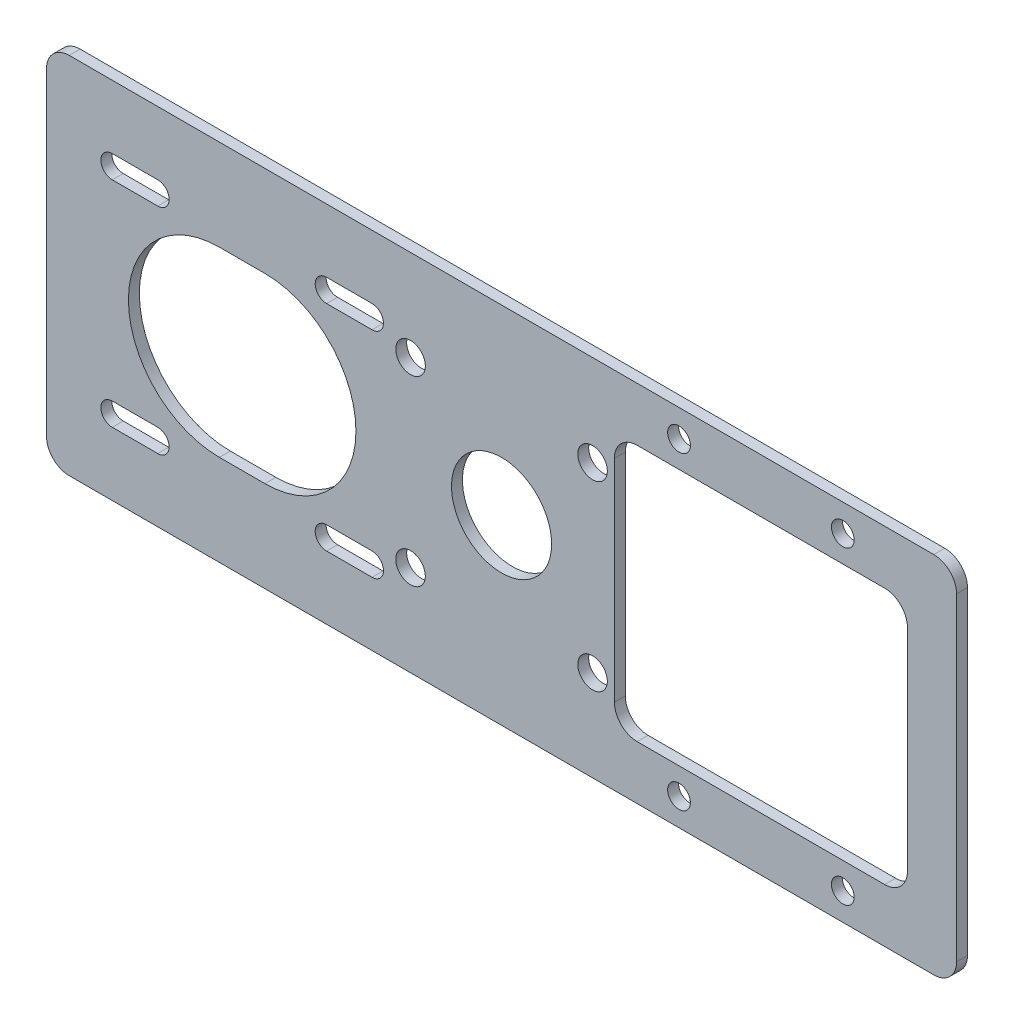
from build123d import *

# Parameters (mm, degrees)
CROQUIS1_W              = 200
CROQUIS1_H              = 80
SALIENTE_EXTRUIR1_DEPTH = 2.4
CROQUIS2_R              = 11
CORTAR_EXTRUIR1_DEPTH   = 108.730032953
CROQUIS3_R              = 3.25
CORTAR_EXTRUIR2_DEPTH   = 108.730032953
CORTAR_EXTRUIR3_DEPTH   = 2.4
CROQUIS7_W              = 64.4
CROQUIS7_H              = 56.4
CORTAR_EXTRUIR4_DEPTH   = 108.730032953
CROQUIS8_R              = 2.5
CORTAR_EXTRUIR5_DEPTH   = 108.730032953
REDONDEO1_R             = 5
REDONDEO2_R             = 5


with BuildPart() as part:
    # Croquis1 → Saliente-Extruir1 (new body)
    with BuildSketch(Plane.XY):
        Rectangle(CROQUIS1_W, CROQUIS1_H)
    extrude(amount=SALIENTE_EXTRUIR1_DEPTH)

    # Croquis2 → Cortar-Extruir1 (cut, through all)
    with BuildSketch(Plane.XY.offset(2.4)):
        Circle(CROQUIS2_R)
    extrude(amount=-CORTAR_EXTRUIR1_DEPTH, mode=Mode.SUBTRACT)

    # Croquis3 → Cortar-Extruir2 (cut, through all)
    with BuildSketch(Plane.XY.offset(2.4)):
        with Locations((20, 20)):
            Circle(CROQUIS3_R)
        with Locations((-20, 20)):
            Circle(CROQUIS3_R)
        with Locations((-20, -20)):
            Circle(CROQUIS3_R)
        with Locations((20, -20)):
            Circle(CROQUIS3_R)
    extrude(amount=-CORTAR_EXTRUIR2_DEPTH, mode=Mode.SUBTRACT)

    # Croquis4 → Cortar-Extruir3 (cut)
    with BuildSketch(Plane.XY.offset(2.4)):
        with BuildLine():
            Line((-62, 20), (-52, 20))
            ThreePointArc((-52, 20), (-32, 0), (-52, -20))
            Line((-52, -20), (-62, -20))
            ThreePointArc((-62, -20), (-82, 0), (-62, 20))
        make_face()
        with BuildLine():
            Line((-85.55, 26.05), (-75.55, 26.05))
            ThreePointArc((-75.55, 26.05), (-73.05, 23.55), (-75.55, 21.05))
            Line((-75.55, 21.05), (-85.55, 21.05))
            ThreePointArc((-85.55, 21.05), (-88.05, 23.55), (-85.55, 26.05))
        make_face()
        with BuildLine():
            Line((-28.45, 21.05), (-38.45, 21.05))
            ThreePointArc((-38.45, 21.05), (-40.95, 23.55), (-38.45, 26.05))
            Line((-38.45, 26.05), (-28.45, 26.05))
            ThreePointArc((-28.45, 26.05), (-25.95, 23.55), (-28.45, 21.05))
        make_face()
        with BuildLine():
            Line((-28.45, -26.05), (-38.45, -26.05))
            ThreePointArc((-38.45, -26.05), (-40.95, -23.55), (-38.45, -21.05))
            Line((-38.45, -21.05), (-28.45, -21.05))
            ThreePointArc((-28.45, -21.05), (-25.95, -23.55), (-28.45, -26.05))
        make_face()
        with BuildLine():
            Line((-85.55, -21.05), (-75.55, -21.05))
            ThreePointArc((-75.55, -21.05), (-73.05, -23.55), (-75.55, -26.05))
            Line((-75.55, -26.05), (-85.55, -26.05))
            ThreePointArc((-85.55, -26.05), (-88.05, -23.55), (-85.55, -21.05))
        make_face()
    extrude(amount=-CORTAR_EXTRUIR3_DEPTH, mode=Mode.SUBTRACT)

    # Croquis7 → Cortar-Extruir4 (cut, through all)
    with BuildSketch(Plane.XY.offset(2.4)):
        with Locations((57, 0)):
            Rectangle(CROQUIS7_W, CROQUIS7_H)
    extrude(amount=-CORTAR_EXTRUIR4_DEPTH, mode=Mode.SUBTRACT)

    # Croquis8 → Cortar-Extruir5 (cut, through all)
    with BuildSketch(Plane.XY.offset(2.4)):
        with Locations((39, 34)):
            Circle(CROQUIS8_R)
        with Locations((75, 34)):
            Circle(CROQUIS8_R)
        with Locations((39, -34)):
            Circle(CROQUIS8_R)
        with Locations((75, -34)):
            Circle(CROQUIS8_R)
    extrude(amount=-CORTAR_EXTRUIR5_DEPTH, mode=Mode.SUBTRACT)

    # Redondeo1
    redondeo1_edges = [part.edges().sort_by_distance(p)[0] for p in [
        (89.2, 28.2, 1.2),
        (89.2, -28.2, 1.2),
        (24.8, -28.2, 1.2),
        (24.8, 28.2, 1.2),
    ]]
    fillet(redondeo1_edges, radius=REDONDEO1_R)

    # Redondeo2
    redondeo2_edges = [part.edges().sort_by_distance(p)[0] for p in [
        (100, -40, 1.2),
        (-100, -40, 1.2),
        (-100, 40, 1.2),
        (100, 40, 1.2),
    ]]
    fillet(redondeo2_edges, radius=REDONDEO2_R)


solid = part.part
